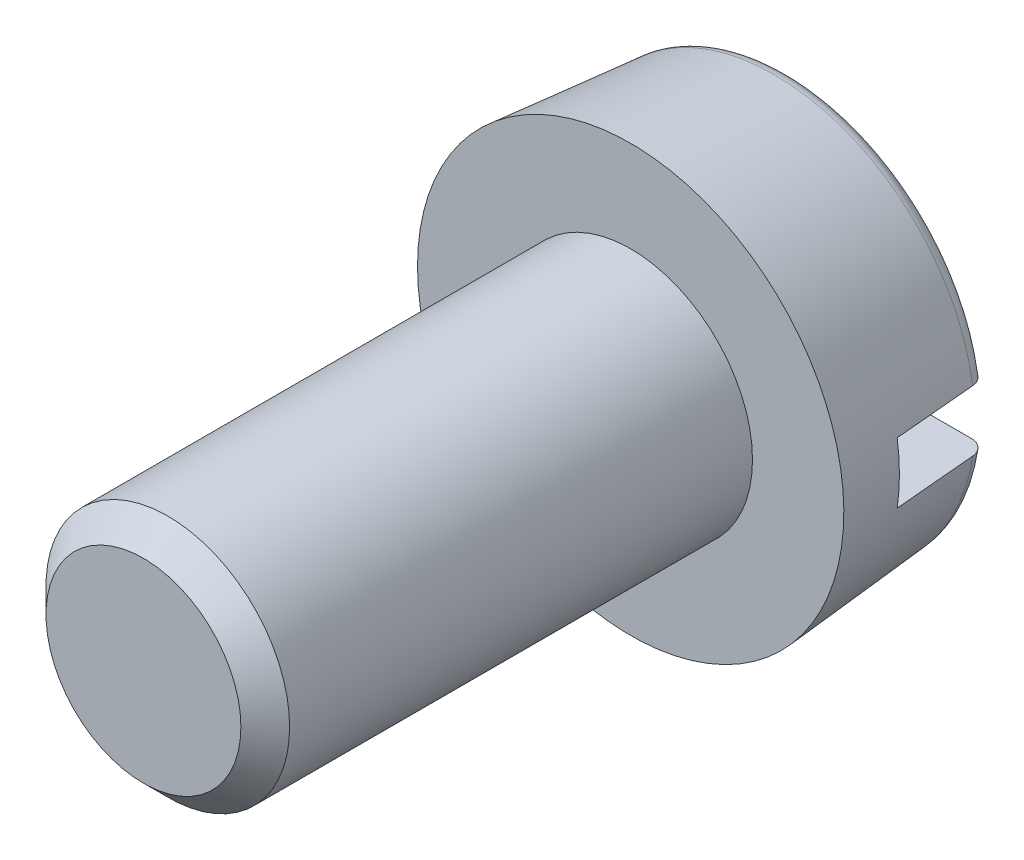
from build123d import *

# Parameters (mm, degrees)
ESQUISSE2_W             = 7
ESQUISSE2_H             = 1
ENLEV_MAT_EXTRU_1_DEPTH = 1.6
ESQUISSE3_W             = 2
ESQUISSE3_H             = 8
CHANFREIN1_SIZE         = 0.4


with BuildPart() as part:
    # Esquisse1 → Base-Révolution (revolve)
    with BuildSketch(Plane(origin=(0, 0, 0), x_dir=(1, 0, 0), z_dir=(0, 1, 0))):
        with BuildLine():
            Line((0, 0), (3.5, 0))
            Line((3.5, 0), (3.293293991, 2.362660493))
            ThreePointArc((3.293293991, 2.362660493), (3.209936824, 2.531692108), (3.03428337, 2.6))
            Line((3.03428337, 2.6), (0, 2.6))
            Line((0, 2.6), (0, 0))
        make_face()
    revolve(axis=Axis((0, 0, 0), (0, 0, -1)))

    # Esquisse2 → Enlev. mat.-Extru.1 (cut)
    with BuildSketch(Plane.XY.offset(-2.6)):
        Rectangle(ESQUISSE2_W, ESQUISSE2_H)
    extrude(amount=ENLEV_MAT_EXTRU_1_DEPTH, mode=Mode.SUBTRACT)

    # Esquisse3 → Boss.-Révol.1 (revolve)
    with BuildSketch(Plane(origin=(0, 0, 0), x_dir=(1, 0, 0), z_dir=(0, 1, 0))):
        with Locations((1, -4)):
            Rectangle(ESQUISSE3_W, ESQUISSE3_H)
    revolve(axis=Axis((0, 0, 0), (0, 0, 1)))

    # Chanfrein1
    chanfrein1_edges = [part.edges().sort_by_distance(p)[0] for p in [
        (-2, 0, 8),
    ]]
    chamfer(chanfrein1_edges, length=CHANFREIN1_SIZE)


solid = part.part
